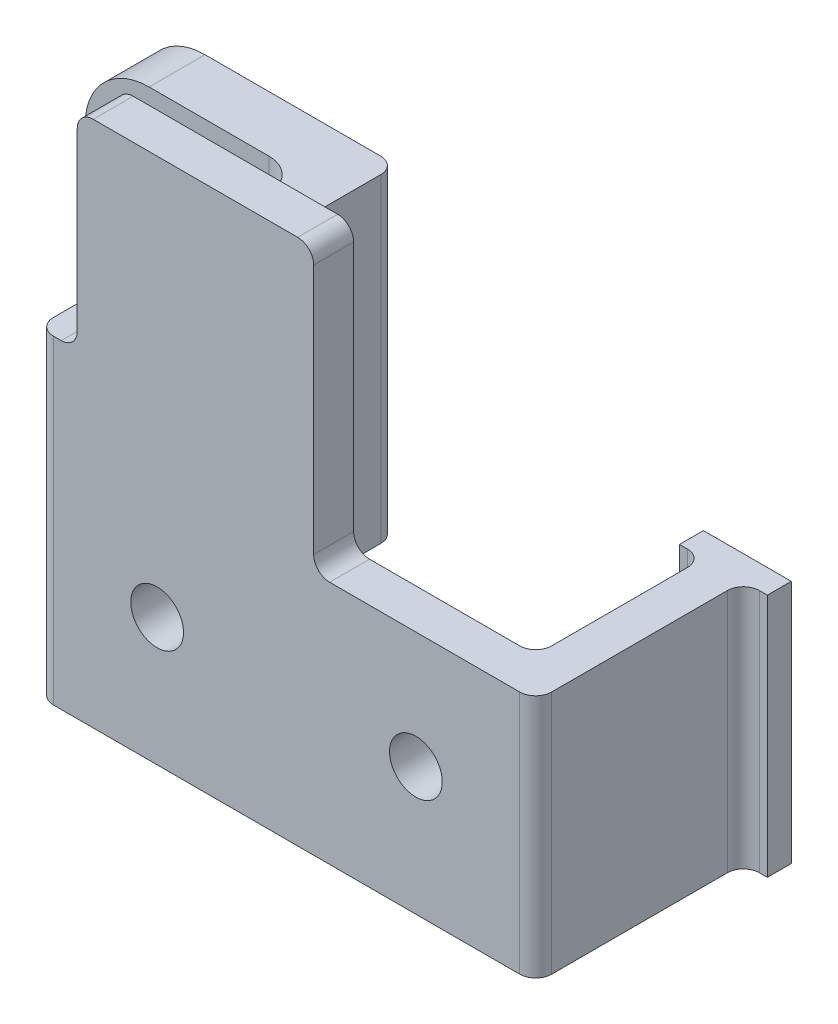
from build123d import *

# Parameters (mm, degrees)
SKETCH1_W            = 14.8
SKETCH1_H            = 17.7
SKETCH1_R            = 1.65
BOSS_EXTRUDE1_DEPTH  = 2.5
FILLET1_R            = 1
SKETCH6_W            = 16.5
SKETCH6_H            = 20
BOSS_EXTRUDE8_DEPTH  = 2.5
SKETCH7_W            = 13.5
SKETCH7_H            = 20
SKETCH7_W_2          = 2.5
BOSS_EXTRUDE9_DEPTH  = 3.5
FILLET5_R            = 2
FILLET6_R            = 1
SKETCH10_W           = 14.5
SKETCH10_H           = 15.3
BOSS_EXTRUDE10_DEPTH = 2.5
SKETCH11_W           = 5.5
SKETCH11_H           = 15.3
BOSS_EXTRUDE11_DEPTH = 1.5
FILLET7_R            = 1
FILLET8_R            = 4


with BuildPart() as part:
    # Sketch1 → Boss-Extrude1 (new body)
    # profile 1 of 2: a face of its own
    with BuildSketch(Plane.XY):
        with Locations((-5.7, 7.65)):
            Rectangle(SKETCH1_W, SKETCH1_H)
    # profile 2 of 2: a face of its own
    with BuildSketch(Plane.XY):
        Polygon((1.7, -1.2), (-13.1, -1.2), (-13.1, -16.5), (13.1, -16.5), (13.1, -1.2), align=None)
        with Locations((-8.1, -8.5)):
            Circle(SKETCH1_R, mode=Mode.SUBTRACT)
        with Locations((8.1, -8.5)):
            Circle(SKETCH1_R, mode=Mode.SUBTRACT)
    extrude(amount=BOSS_EXTRUDE1_DEPTH)

    # Fillet1
    fillet1_edges = [part.edges().sort_by_distance(p)[0] for p in [
        (1.7, 16.5, 1.25),
        (-13.1, 16.5, 1.25),
    ]]
    fillet(fillet1_edges, radius=FILLET1_R)

    # Sketch6 → Boss-Extrude8 (add)
    with BuildSketch(Plane.ZY.offset(13.1)):
        with Locations((-5.75, -6.5)):
            Rectangle(SKETCH6_W, SKETCH6_H)
    extrude(amount=BOSS_EXTRUDE8_DEPTH)

    # Sketch7 → Boss-Extrude9 (add)
    # profile 1 of 2: a face of its own
    with BuildSketch(Plane(origin=(0, 0, -14), x_dir=(-1, 0, 0), z_dir=(0, 0, -1))):
        with Locations((22.35, -6.5)):
            Rectangle(SKETCH7_W, SKETCH7_H)
        with BuildLine():
            ThreePointArc((20.2, -5.1), (22.9, -2.4), (25.6, -5.1))
            Line((25.6, -5.1), (25.6, -10.5))
            ThreePointArc((25.6, -10.5), (22.9, -13.2), (20.2, -10.5))
            Line((20.2, -10.5), (20.2, -5.1))
        make_face(mode=Mode.SUBTRACT)
    # profile 2 of 2: a face of its own
    with BuildSketch(Plane(origin=(0, 0, -14), x_dir=(-1, 0, 0), z_dir=(0, 0, -1))):
        with Locations((14.35, -6.5)):
            Rectangle(SKETCH7_W_2, SKETCH7_H)
    extrude(amount=BOSS_EXTRUDE9_DEPTH)

    # Fillet5
    fillet5_edges = [part.edges().sort_by_distance(p)[0] for p in [
        (-13.1, -6.5, 0),
        (-15.6, -6.5, -14),
    ]]
    fillet(fillet5_edges, radius=FILLET5_R)

    # Fillet6
    fillet6_edges = [part.edges().sort_by_distance(p)[0] for p in [
        (-13.1, 3.5, 1.25),
        (-15.6, -6.5, 2.5),
    ]]
    fillet(fillet6_edges, radius=FILLET6_R)

    # Sketch10 → Boss-Extrude10 (add)
    with BuildSketch(Plane(origin=(13.1, 0, 0), x_dir=(0, 0, -1), z_dir=(1, 0, 0))):
        with Locations((4.75, -8.85)):
            Rectangle(SKETCH10_W, SKETCH10_H)
    extrude(amount=BOSS_EXTRUDE10_DEPTH)

    # Sketch11 → Boss-Extrude11 (add)
    with BuildSketch(Plane(origin=(0, 0, -12), x_dir=(-1, 0, 0), z_dir=(0, 0, -1))):
        with Locations((-14.35, -8.85)):
            Rectangle(SKETCH11_W, SKETCH11_H)
    extrude(amount=-BOSS_EXTRUDE11_DEPTH)

    # Fillet7
    fillet7_edges = [part.edges().sort_by_distance(p)[0] for p in [
        (13.1, -8.85, 0),
        (15.6, -8.85, 2.5),
        (15.6, -8.85, -10.5),
        (13.1, -8.85, -10.5),
        (1.7, -1.2, 1.25),
        (-13.1, -6.5, -17.5),
    ]]
    fillet(fillet7_edges, radius=FILLET7_R)

    # Fillet8
    fillet8_edges = [part.edges().sort_by_distance(p)[0] for p in [
        (-29.1, -16.5, -15.75),
        (-29.1, 3.5, -15.75),
    ]]
    fillet(fillet8_edges, radius=FILLET8_R)


solid = part.part
